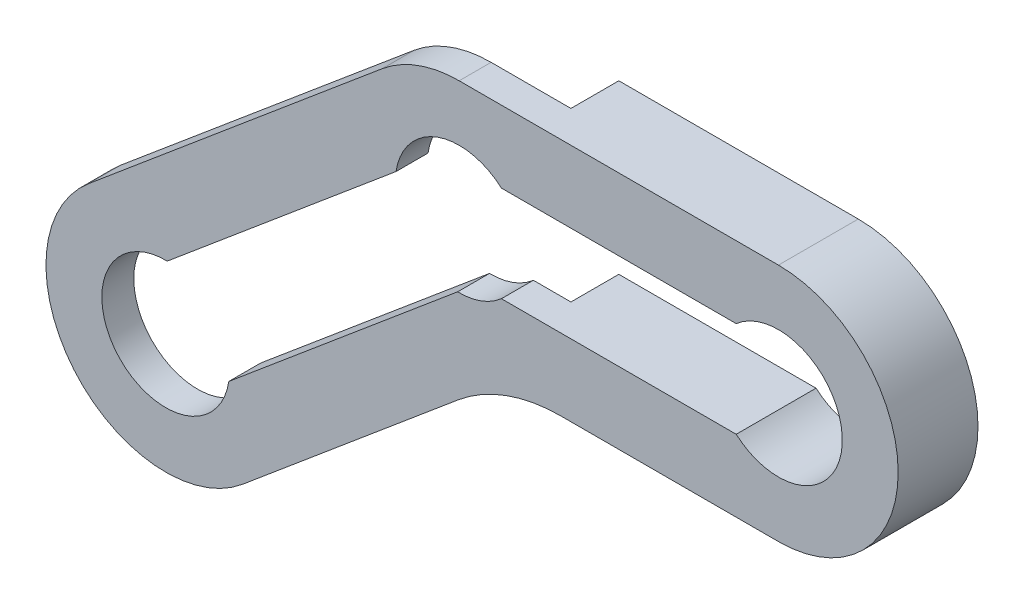
from build123d import *
from build123d.topology import SkipClean

# Parameters (mm, degrees)
SKETCH_1_R          = 7.5
SKETCH_1_R_2        = 4
EXTRUDE_1_DEPTH     = 2
FILLET_1_R          = 10
EXTRUDE_START       = 3
SKETCH_2_R          = 4
EXTRUDE_2_DEPTH     = 3
CUT_EXTRUDE_1_DEPTH = 52.537192438


with BuildPart() as part:
    # Эскиз1 → Бобышка-Вытянуть1 (new body)
    # profile 1 of 6: a face of its own
    with BuildSketch(Plane.XY):
        with Locations((-38.385066635, -15.426902632)):
            Circle(SKETCH_1_R)
        with Locations((-38.385066635, -15.426902632)):
            Circle(SKETCH_1_R_2, mode=Mode.SUBTRACT)
    # profile 2 of 6: a face of its own
    with BuildSketch(Plane.XY):
        with BuildLine():
            ThreePointArc((-20, -7.5), (-27.047694656, -2.565151075), (-24.820907073, 5.745333323))
            Line((-24.820907073, 5.745333323), (-43.205973708, -9.681569309))
            ThreePointArc((-43.205973708, -9.681569309), (-35.215429672, -8.62959423), (-30.885066635, -15.426902632))
            ThreePointArc((-30.885066635, -15.426902632), (-31.587758232, -18.596539596), (-33.564159562, -21.172235956))
            Line((-33.564159562, -21.172235956), (-17.270223243, -7.5))
            Line((-17.270223243, -7.5), (-20, -7.5))
        make_face()
    # profile 3 of 6: a face of its own
    with BuildSketch(Plane.XY):
        with Locations((-20, 0)):
            Circle(SKETCH_1_R)
        with Locations((-20, 0)):
            Circle(SKETCH_1_R_2, mode=Mode.SUBTRACT)
    # profile 4 of 6: a face of its own
    with BuildSketch(Plane.XY):
        with BuildLine():
            Line((-20, -7.5), (-17.270223243, -7.5))
            Line((-17.270223243, -7.5), (-15.179092927, -5.745333323))
            ThreePointArc((-15.179092927, -5.745333323), (-17.434848925, -7.047694656), (-20, -7.5))
        make_face()
    # profile 5 of 6: a face of its own
    with BuildSketch(Plane.XY):
        with BuildLine():
            ThreePointArc((0, -7.5), (-7.5, 0), (0, 7.5))
            Line((0, 7.5), (-20, 7.5))
            ThreePointArc((-20, 7.5), (-14.696699141, 5.303300859), (-12.5, 0))
            ThreePointArc((-12.5, 0), (-13.202691597, -3.169636963), (-15.179092927, -5.745333323))
            Line((-15.179092927, -5.745333323), (-17.270223243, -7.5))
            Line((-17.270223243, -7.5), (0, -7.5))
        make_face()
    # profile 6 of 6: a face of its own
    with BuildSketch(Plane.XY):
        Circle(SKETCH_1_R)
        Circle(SKETCH_1_R_2, mode=Mode.SUBTRACT)
    extrude(amount=EXTRUDE_1_DEPTH)

    # Скругление1
    fillet_1_edges = [part.edges().sort_by_distance(p)[0] for p in [
        (-17.270223243, -7.5, 1),
    ]]
    fillet(fillet_1_edges, radius=FILLET_1_R)

    # Эскиз2 → Бобышка-Вытянуть2 (add)
    with SkipClean():  # the faces are left unmerged after this step: merging them gives an invalid solid
        with BuildSketch(Plane(origin=(0, 0, 0), x_dir=(-1, 0, 0), z_dir=(0, 0, -1)).offset(EXTRUDE_START)):
            with BuildLine():
                Line((0, -7.5), (15, -7.5))
                Line((15, -7.5), (15, 7.5))
                Line((15, 7.5), (0, 7.5))
                ThreePointArc((0, 7.5), (-7.5, 0), (0, -7.5))
            make_face()
            Circle(SKETCH_2_R, mode=Mode.SUBTRACT)
        extrude(amount=-EXTRUDE_2_DEPTH)

    # Эскиз4 → Вырез-Вытянуть1 (cut, through all)
    with BuildSketch(Plane.XY.offset(2)):
        with BuildLine():
            Line((-23.955125919, 0.597477168), (-38.286666374, -11.428113142))
            ThreePointArc((-38.286666374, -11.428113142), (-35.52206113, -12.633481884), (-34.385066635, -15.426902632))
            ThreePointArc((-34.385066635, -15.426902632), (-34.396300931, -15.726482609), (-34.429940716, -16.024379801))
            Line((-34.429940716, -16.024379801), (-20.098400261, -3.99878949))
            ThreePointArc((-20.098400261, -3.99878949), (-23.064177772, -2.571150439), (-23.955125919, 0.597477168))
        make_face()
        with BuildLine():
            Line((-2.645751311, 3), (-17.354248689, 3))
            ThreePointArc((-17.354248689, 3), (-16.354248689, 1.645751311), (-16, 0))
            ThreePointArc((-16, 0), (-16.354248689, -1.645751311), (-17.354248689, -3))
            Line((-17.354248689, -3), (-2.645751311, -3))
            ThreePointArc((-2.645751311, -3), (-4, 0), (-2.645751311, 3))
        make_face()
    extrude(amount=-CUT_EXTRUDE_1_DEPTH, mode=Mode.SUBTRACT)


solid = part.part
